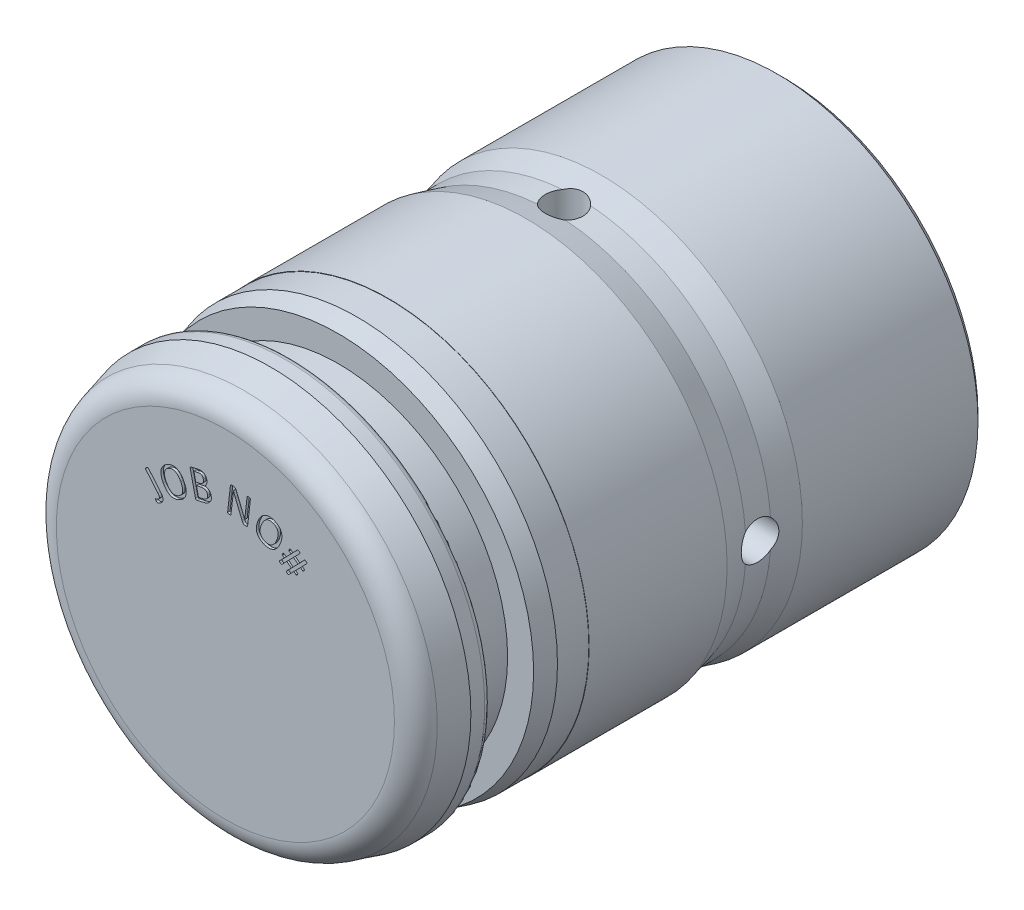
from build123d import *

# Parameters (mm, degrees)
SKETCH2_W                                            = 1.5
SKETCH2_H                                            = 8
CIRPATTERN1_COUNT                                    = 4
CSK_FOR_M2_5_CROSS_COUNTERSUNK_HEAD_SCRE_D           = 3.15
CSK_FOR_M2_5_CROSS_COUNTERSUNK_HEAD_SCRE_DEPTH       = 2.053644525
CSK_FOR_M2_5_CROSS_COUNTERSUNK_HEAD_SCRE_CSINK_D     = 4.5
CSK_FOR_M2_5_CROSS_COUNTERSUNK_HEAD_SCRE_CSINK_ANGLE = 92
CSK_FOR_M2_5_CROSS_COUNTERSUNK_HEAD_SCRE_TIP         = 0.946355475
SKETCH7_R                                            = 13.476607606
CUT_EXTRUDE1_DEPTH                                   = 50.922439908
CUT_EXTRUDE2_DEPTH                                   = 0.2


with BuildPart() as part:
    # Sketch1 → Revolve1 (revolve)
    with BuildSketch(Plane(origin=(0, 0, 0), x_dir=(0, 0, -1), z_dir=(1, 0, 0)), mode=Mode.PRIVATE) as revolve1_sk:
        with BuildLine():
            Line((34, 16), (36, 15.5))
            Line((36, 15.5), (38, 15.5))
            Line((38, 15.5), (40, 16))
            Line((40, 16), (54, 16))
            Line((54, 16), (54.5, 15.5))
            Line((54.5, 15.5), (54.5, 13.277350269))
            Line((54.5, 13.277350269), (53.5, 12.7))
            Line((53.5, 12.7), (39.445481322, 12.7))
            Line((39.445481322, 12.7), (38.003527618, 13.086370331))
            ThreePointArc((38.003527618, 13.086370331), (37.656495428, 13.017341336), (37.5, 12.7))
            Line((37.5, 12.7), (37.5, 9.577350269))
            Line((37.5, 9.577350269), (36.5, 9))
            Line((36.5, 9), (21.945481322, 9))
            Line((21.945481322, 9), (20.503527618, 9.386370331))
            ThreePointArc((20.503527618, 9.386370331), (20.156495428, 9.317341336), (20, 9))
            Line((20, 9), (20, 5))
            Line((20, 5), (16.995696905, 0))
            Line((16.995696905, 0), (0, 0))
            Line((0, 0), (0, 5))
            Line((0, 5), (10, 5))
            Line((10, 5), (10, 13.476607606))
            ThreePointArc((10, 13.476607606), (10.413293319, 14.694130464), (11.48236191, 15.408459258))
            Line((11.48236191, 15.408459258), (13.596720742, 15.975))
            Line((13.596720742, 15.975), (14.7, 15.975))
            ThreePointArc((14.7, 15.975), (15.053553391, 15.828553391), (15.2, 15.475))
            Line((15.2, 15.475), (15.2, 13.5))
            Line((15.2, 13.5), (19, 13.5))
            Line((19, 13.5), (19, 15.573076211))
            Line((19, 15.573076211), (20.5, 15.975))
            Line((20.5, 15.975), (23, 15.975))
            Line((23, 15.975), (23, 16))
            Line((23, 16), (34, 16))
        make_face()
    revolve(revolve1_sk.sketch.rotate(Axis((0, 0, 0), (0, 0, -1)), 90), axis=Axis((0, 0, 0), (0, 0, -1)))

    # Sketch2 → Cut-Revolve1 (revolve, cut)
    with BuildSketch(Plane(origin=(0, 0, 0), x_dir=(0, 0, -1), z_dir=(1, 0, 0)), mode=Mode.PRIVATE) as cut_revolve1_sk:
        with Locations((37.75, 12)):
            Rectangle(SKETCH2_W, SKETCH2_H)
    cut_revolve1 = revolve(cut_revolve1_sk.sketch.rotate(Axis((0, 16, -37), (0, -1, 0)), 228.189685086), axis=Axis((0, 16, -37), (0, -1, 0)), mode=Mode.SUBTRACT)

    # CirPattern1: Cut-Revolve1 ×4 about axis
    cirpattern1_axis = Axis((0, 0, -34), (0, 0, 1))
    for i in range(1, CIRPATTERN1_COUNT):
        add(cut_revolve1.rotate(cirpattern1_axis, i * 360 / CIRPATTERN1_COUNT), mode=Mode.SUBTRACT)

    # CSK for M2.5 Cross Countersunk Head Screw1
    with Locations(Plane.XY):
        with Locations((0, 0)):
            CounterSinkHole(CSK_FOR_M2_5_CROSS_COUNTERSUNK_HEAD_SCRE_D / 2, CSK_FOR_M2_5_CROSS_COUNTERSUNK_HEAD_SCRE_CSINK_D / 2, depth=CSK_FOR_M2_5_CROSS_COUNTERSUNK_HEAD_SCRE_DEPTH, counter_sink_angle=CSK_FOR_M2_5_CROSS_COUNTERSUNK_HEAD_SCRE_CSINK_ANGLE)
            with Locations((0, 0, -(CSK_FOR_M2_5_CROSS_COUNTERSUNK_HEAD_SCRE_DEPTH + CSK_FOR_M2_5_CROSS_COUNTERSUNK_HEAD_SCRE_TIP / 2))):  # 118° drill point
                Cone(0, CSK_FOR_M2_5_CROSS_COUNTERSUNK_HEAD_SCRE_D / 2, CSK_FOR_M2_5_CROSS_COUNTERSUNK_HEAD_SCRE_TIP, mode=Mode.SUBTRACT)

    # Sketch7 → Cut-Extrude1 (cut, through all)
    with BuildSketch(Plane.XY.offset(-10)):
        Circle(SKETCH7_R)
    extrude(amount=CUT_EXTRUDE1_DEPTH, mode=Mode.SUBTRACT)

    # Sketch8 → Cut-Extrude2 (cut)
    # profile 1 of 6: a face of its own
    with BuildSketch(Plane.XY.offset(-10)):
        with BuildLine():
            add(Edge.make_bspline(
                [(6.260781459, 6.830002782), (6.255392421, 6.823251937), (6.245424638, 6.8107653), (6.229883709, 6.79496212), (6.215150833, 6.783513313), (6.201426796, 6.775772359), (6.18806834, 6.772091301), (6.175389731, 6.771895126), (6.163862875, 6.775645539), (6.157125762, 6.779468215), (6.153780846, 6.78136614)],
                knots=[0, 0, 0, 0, 1.585463742, 2.932538266, 4.057772045, 5.003295333, 5.804780796, 6.57870779, 7.294341131, 8, 8, 8, 8], degree=3))
            Line((6.153780846, 6.78136614), (5.982579866, 6.911712341))
            Line((5.982579866, 6.911712341), (5.601268591, 6.517269173))
            Line((5.601268591, 6.517269173), (5.753014915, 6.402000331))
            add(Edge.make_bspline(
                [(5.753014915, 6.402000331), (5.758590073, 6.396410027), (5.770478598, 6.384489204), (5.770440269, 6.361319518), (5.767068702, 6.341494444), (5.75913833, 6.324157511), (5.748284318, 6.304681883), (5.738759574, 6.291811589), (5.733560258, 6.284786024)],
                knots=[0, 0, 0, 0, 1.043117624, 2.224354699, 2.946775228, 3.812145065, 4.805705605, 6, 6, 6, 6], degree=3))
            add(Edge.make_bspline(
                [(5.733560258, 6.284786024), (5.728180668, 6.278036114), (5.718158393, 6.265460907), (5.702387722, 6.249550343), (5.686722075, 6.239092766), (5.673392145, 6.230381813), (5.660004977, 6.22712137), (5.647545047, 6.226069177), (5.636257658, 6.229878394), (5.629735903, 6.233768457), (5.626559645, 6.235663015)],
                knots=[0, 0, 0, 0, 1.588142171, 2.958738167, 4.092165376, 5.053725356, 5.856564822, 6.602578649, 7.319420957, 8, 8, 8, 8], degree=3))
            Line((5.626559645, 6.235663015), (5.452440466, 6.367954682))
            Line((5.452440466, 6.367954682), (5.058483665, 5.962325086))
            add(Edge.make_bspline(
                [(5.058483665, 5.962325086), (5.055813071, 5.959801269), (5.050556351, 5.95483346), (5.041311884, 5.949067243), (5.029811592, 5.947108565), (5.016569173, 5.948865859), (5.000896152, 5.954868363), (4.982079824, 5.964916974), (4.959586499, 5.980687804), (4.943175599, 5.992917821), (4.933973861, 5.9997753)],
                knots=[0, 0, 0, 0, 0.614242039, 1.20905647, 1.788239831, 2.524253971, 3.415446644, 4.578871761, 6.081742834, 8, 8, 8, 8], degree=3))
            add(Edge.make_bspline(
                [(4.933973861, 5.9997753), (4.925051654, 6.006727675), (4.908782358, 6.019405058), (4.88680092, 6.036846582), (4.871730259, 6.0533563), (4.86059154, 6.066819748), (4.855243214, 6.079414382), (4.854471824, 6.090834027), (4.858147863, 6.101070964), (4.862921708, 6.106429953), (4.865396195, 6.109207745)],
                knots=[0, 0, 0, 0, 1.864673509, 3.400159188, 4.609467308, 5.544287496, 6.263453322, 6.824981007, 7.390937711, 8, 8, 8, 8], degree=3))
            Line((4.865396195, 6.109207745), (5.25886663, 6.514837341))
            Line((5.25886663, 6.514837341), (4.895550913, 6.790607102))
            Line((4.895550913, 6.790607102), (4.501594112, 6.385463873))
            add(Edge.make_bspline(
                [(4.501594112, 6.385463873), (4.498522748, 6.383198177), (4.492526898, 6.378775137), (4.48369997, 6.372306558), (4.472687947, 6.369718636), (4.459941703, 6.370931692), (4.445010759, 6.37731339), (4.426056196, 6.3862617), (4.404285302, 6.402647864), (4.3878089, 6.41437428), (4.378543407, 6.420968622)],
                knots=[0, 0, 0, 0, 0.648675436, 1.266329842, 1.832952999, 2.522279822, 3.400518836, 4.568238135, 6.070151066, 8, 8, 8, 8], degree=3))
            add(Edge.make_bspline(
                [(4.378543407, 6.420968622), (4.369301544, 6.428250886), (4.352564335, 6.441439221), (4.330077141, 6.459342747), (4.314838614, 6.476006452), (4.303702362, 6.489472575), (4.298353594, 6.502066729), (4.297582287, 6.513486465), (4.301258306, 6.52372338), (4.306032154, 6.529082372), (4.308506642, 6.531860166)],
                knots=[0, 0, 0, 0, 1.912748068, 3.464026874, 4.656544041, 5.578384475, 6.287564856, 6.841295863, 7.399394395, 8, 8, 8, 8], degree=3))
            Line((4.308506642, 6.531860166), (4.701004345, 6.937976128))
            Line((4.701004345, 6.937976128), (4.549258021, 7.05324497))
            add(Edge.make_bspline(
                [(4.549258021, 7.05324497), (4.543815426, 7.059001284), (4.53251164, 7.070956638), (4.530248895, 7.093646184), (4.535190759, 7.112737911), (4.54181828, 7.13040149), (4.553727353, 7.149277476), (4.5628236, 7.162396154), (4.567739945, 7.169486544)],
                knots=[0, 0, 0, 0, 1.069317819, 2.220877998, 2.931803983, 3.795872364, 4.808711869, 6, 6, 6, 6], degree=3))
            add(Edge.make_bspline(
                [(4.567739945, 7.169486544), (4.573098097, 7.17610876), (4.583077422, 7.18844235), (4.59923175, 7.203651854), (4.614318306, 7.214724536), (4.627725911, 7.223116555), (4.640658476, 7.228016865), (4.653272994, 7.228247395), (4.665396146, 7.226119002), (4.672249147, 7.221777091), (4.675713291, 7.219582286)],
                knots=[0, 0, 0, 0, 1.556242223, 2.898433828, 4.04270965, 4.97307966, 5.788695267, 6.530389247, 7.25712215, 8, 8, 8, 8], degree=3))
            Line((4.675713291, 7.219582286), (4.850805203, 7.086804253))
            Line((4.850805203, 7.086804253), (5.233575576, 7.480274688))
            Line((5.233575576, 7.480274688), (5.075506489, 7.599920827))
            add(Edge.make_bspline(
                [(5.075506489, 7.599920827), (5.069985597, 7.605679466), (5.058419075, 7.617744075), (5.057396303, 7.640574947), (5.06110296, 7.659862334), (5.068338396, 7.676790651), (5.078569322, 7.695490297), (5.087655927, 7.707679529), (5.092529314, 7.714216937)],
                knots=[0, 0, 0, 0, 1.090307583, 2.284244036, 3.004444687, 3.864255633, 4.854543841, 6, 6, 6, 6], degree=3))
            add(Edge.make_bspline(
                [(5.092529314, 7.714216937), (5.098089875, 7.721284352), (5.108402419, 7.734391489), (5.124267597, 7.751125455), (5.139523842, 7.76323454), (5.157294098, 7.772614631), (5.179867334, 7.777579752), (5.194520077, 7.76957259), (5.201475392, 7.765771777)],
                knots=[0, 0, 0, 0, 1.210425649, 2.244839576, 3.100739761, 3.813534997, 4.962136101, 6, 6, 6, 6], degree=3))
            Line((5.201475392, 7.765771777), (5.379485503, 7.630561912))
            Line((5.379485503, 7.630561912), (5.751555815, 8.009927721))
            add(Edge.make_bspline(
                [(5.751555815, 8.009927721), (5.75435087, 8.012534766), (5.759653855, 8.017481046), (5.769769865, 8.022139091), (5.781382305, 8.024335537), (5.795393983, 8.021607521), (5.812069383, 8.015534526), (5.83220298, 8.004873159), (5.856212692, 7.989528488), (5.8730722, 7.976979797), (5.882388383, 7.970045674)],
                knots=[0, 0, 0, 0, 0.610955433, 1.159149706, 1.767875367, 2.47958279, 3.419728211, 4.620874901, 6.132771931, 8, 8, 8, 8], degree=3))
            add(Edge.make_bspline(
                [(5.882388383, 7.970045674), (5.891609161, 7.963082924), (5.90806768, 7.950654847), (5.928300018, 7.931819789), (5.942905842, 7.916230374), (5.952275354, 7.902928047), (5.957011156, 7.890967827), (5.956511938, 7.880316188), (5.95252599, 7.871374276), (5.948949584, 7.866228456), (5.947075117, 7.863531428)],
                knots=[0, 0, 0, 0, 1.986804467, 3.546322913, 4.751095073, 5.65636833, 6.335717192, 6.922228838, 7.435118393, 8, 8, 8, 8], degree=3))
            Line((5.947075117, 7.863531428), (5.573059339, 7.483679253))
            Line((5.573059339, 7.483679253), (5.936375055, 7.207909492))
            Line((5.936375055, 7.207909492), (6.305527169, 7.589220766))
            add(Edge.make_bspline(
                [(6.305527169, 7.589220766), (6.308335688, 7.591653775), (6.313958121, 7.596524468), (6.324576798, 7.600972173), (6.336697584, 7.602493388), (6.350594068, 7.599981105), (6.367021365, 7.594393037), (6.386878767, 7.584108468), (6.410936407, 7.568574638), (6.428167955, 7.555932719), (6.437818836, 7.548852353)],
                knots=[0, 0, 0, 0, 0.591456287, 1.184048898, 1.811383024, 2.519327369, 3.421549894, 4.581491105, 6.085394137, 8, 8, 8, 8], degree=3))
            add(Edge.make_bspline(
                [(6.437818836, 7.548852353), (6.446862425, 7.541869431), (6.463265101, 7.529204261), (6.483537352, 7.510270892), (6.498362673, 7.494706002), (6.507281717, 7.481347005), (6.511255541, 7.469534438), (6.511472308, 7.459040618), (6.507843748, 7.449804198), (6.503632691, 7.445146864), (6.501532837, 7.442824473)],
                knots=[0, 0, 0, 0, 1.973985317, 3.580286544, 4.790602399, 5.684799368, 6.33182712, 6.920370663, 7.461640368, 8, 8, 8, 8], degree=3))
            Line((6.501532837, 7.442824473), (6.129462525, 7.061513199))
            Line((6.129462525, 7.061513199), (6.279749749, 6.94721709))
            add(Edge.make_bspline(
                [(6.279749749, 6.94721709), (6.285247067, 6.941457087), (6.296992743, 6.929150153), (6.298111643, 6.905649413), (6.293558262, 6.886047723), (6.286520013, 6.868506934), (6.274947455, 6.849793952), (6.265728457, 6.836914183), (6.260781459, 6.830002782)],
                knots=[0, 0, 0, 0, 1.06110144, 2.267169949, 2.994302627, 3.831081759, 4.83613885, 6, 6, 6, 6], degree=3))
        make_face()
        Polygon((5.426176679, 7.333878395), (5.044379038, 6.939921593), (5.406235656, 6.665124565), (5.790465129, 7.057135901), align=None, mode=Mode.SUBTRACT)
    # profile 2 of 6: a face of its own
    with BuildSketch(Plane.XY.offset(-10)):
        with BuildLine():
            add(Edge.make_bspline(
                [(4.374029615, 7.750312123), (4.357364755, 7.711806452), (4.324736361, 7.636415584), (4.268149739, 7.530048713), (4.207406159, 7.432099581), (4.141660797, 7.343606082), (4.072339953, 7.263744696), (3.998155965, 7.194322075), (3.919849029, 7.135100096), (3.837966362, 7.085373345), (3.751612108, 7.046877581), (3.661656585, 7.018120099), (3.567457298, 7.001539268), (3.469782172, 6.994349952), (3.368277258, 6.999666792), (3.263475247, 7.01640966), (3.155220765, 7.045227789), (3.083938942, 7.073058979), (3.047222017, 7.087394691)],
                knots=[0, 0, 0, 0, 1.193394181, 2.336565484, 3.424498174, 4.469779062, 5.470007252, 6.429519284, 7.354859414, 8.259079089, 9.148971895, 10.038900566, 10.939158173, 11.863980772, 12.819949185, 13.824031056, 14.879168859, 16, 16, 16, 16], degree=3))
            add(Edge.make_bspline(
                [(3.047222017, 7.087394691), (3.011743395, 7.102993509), (2.943149682, 7.133151977), (2.848194338, 7.187049719), (2.763881468, 7.245876273), (2.690419149, 7.310282395), (2.627662126, 7.379743315), (2.575245973, 7.453777231), (2.532226577, 7.532012565), (2.500634503, 7.615420252), (2.479132239, 7.703476117), (2.467672085, 7.796165139), (2.465911041, 7.893613414), (2.474020414, 7.995663031), (2.491707574, 8.102365685), (2.519518649, 8.21314739), (2.555342377, 8.328677731), (2.585934524, 8.405641058), (2.601710375, 8.44532974)],
                knots=[0, 0, 0, 0, 1.136319349, 2.196938858, 3.197072658, 4.147329943, 5.056522752, 5.93666825, 6.802812793, 7.668382657, 8.545013404, 9.455796929, 10.402393608, 11.399265577, 12.454765395, 13.57131697, 14.747569374, 16, 16, 16, 16], degree=3))
            add(Edge.make_bspline(
                [(2.601710375, 8.44532974), (2.618010739, 8.483048161), (2.649855857, 8.556736549), (2.706071296, 8.660491727), (2.765337111, 8.756899641), (2.830821402, 8.843983084), (2.900154456, 8.922698919), (2.97400393, 8.991465622), (3.052081679, 9.050042938), (3.134055774, 9.098499499), (3.220363242, 9.136801888), (3.310636318, 9.164615502), (3.404839664, 9.181686605), (3.502741475, 9.187949271), (3.604223992, 9.182968356), (3.709013045, 9.166017986), (3.817115271, 9.137293434), (3.888396691, 9.109454817), (3.925113408, 9.095115279)],
                knots=[0, 0, 0, 0, 1.176456083, 2.298377034, 3.376910023, 4.41529402, 5.415304523, 6.37812314, 7.300408847, 8.205975924, 9.099978399, 9.998960489, 10.905289328, 11.836036068, 12.803089969, 13.809356579, 14.871610106, 16, 16, 16, 16], degree=3))
            add(Edge.make_bspline(
                [(3.925113408, 9.095115279), (3.959963462, 9.07987317), (4.027500951, 9.0503348), (4.120662682, 8.996706276), (4.204307587, 8.939008706), (4.277053987, 8.874985787), (4.339777578, 8.806186141), (4.392419206, 8.732575358), (4.435040147, 8.654171874), (4.467867543, 8.571072247), (4.490171741, 8.483280682), (4.502746306, 8.391113157), (4.505612092, 8.294270985), (4.497779769, 8.19304946), (4.481069397, 8.087688137), (4.454964212, 7.978311841), (4.419439854, 7.864902593), (4.389441083, 7.789202193), (4.374029615, 7.750312123)],
                knots=[0, 0, 0, 0, 1.125861885, 2.181858496, 3.178301479, 4.130985709, 5.045423654, 5.930180416, 6.804714192, 7.682143433, 8.569606438, 9.480950256, 10.432156948, 11.433539705, 12.48351445, 13.588831494, 14.761294367, 16, 16, 16, 16], degree=3))
        make_face()
        with BuildLine():
            add(Edge.make_bspline(
                [(4.091450724, 7.845639942), (4.10240631, 7.873267029), (4.123889782, 7.927442662), (4.151258902, 8.009068097), (4.173543643, 8.089128298), (4.191376972, 8.167587357), (4.203442014, 8.244080589), (4.207804044, 8.318342993), (4.205516335, 8.389853698), (4.196312574, 8.458657682), (4.180312144, 8.524861669), (4.154220854, 8.587154031), (4.121262688, 8.646450346), (4.079173625, 8.70201945), (4.028414673, 8.754007466), (3.967151949, 8.800604059), (3.896745057, 8.843477526), (3.844684948, 8.866322209), (3.817626429, 8.878195855)],
                knots=[0, 0, 0, 0, 1.169145165, 2.292647769, 3.3852338, 4.437530758, 5.456893215, 6.428122432, 7.359928579, 8.267424953, 9.15541128, 10.030753632, 10.916078564, 11.817998595, 12.765199665, 13.765464758, 14.838588412, 16, 16, 16, 16], degree=3))
            add(Edge.make_bspline(
                [(3.817626429, 8.878195855), (3.790097306, 8.888653437), (3.736971863, 8.908834382), (3.656777326, 8.928899065), (3.579644277, 8.936715052), (3.506030846, 8.934392328), (3.436025693, 8.92243832), (3.369475416, 8.902870874), (3.306038334, 8.875945607), (3.246185256, 8.841138105), (3.189436909, 8.799396453), (3.13575998, 8.751082808), (3.085667859, 8.695830851), (3.039262654, 8.634508851), (2.996201616, 8.568243927), (2.95598785, 8.498406056), (2.918768958, 8.42519292), (2.896835715, 8.374602743), (2.885748365, 8.349029188)],
                knots=[0, 0, 0, 0, 1.162333523, 2.243060363, 3.253399692, 4.214251443, 5.142559219, 6.05012643, 6.947931396, 7.857168051, 8.777850264, 9.72529952, 10.70417548, 11.718300799, 12.758857461, 13.822939541, 14.899486486, 16, 16, 16, 16], degree=3))
            add(Edge.make_bspline(
                [(2.885748365, 8.349029188), (2.874445506, 8.320599164), (2.852212153, 8.264675723), (2.824267661, 8.180658745), (2.800674232, 8.098605019), (2.781963126, 8.018849745), (2.769533569, 7.941341628), (2.764060142, 7.866647556), (2.765278981, 7.794793696), (2.773866772, 7.725883755), (2.790345504, 7.660073942), (2.815369761, 7.597984903), (2.8484386, 7.539205096), (2.890105871, 7.483940136), (2.941073805, 7.432215049), (3.003142552, 7.38625175), (3.074103387, 7.34288394), (3.126830222, 7.319741524), (3.15422263, 7.30771868)],
                knots=[0, 0, 0, 0, 1.192592052, 2.345894933, 3.450268716, 4.520489015, 5.537831291, 6.507398402, 7.436738483, 8.335193501, 9.209009476, 10.0740487, 10.937238559, 11.830990001, 12.765111078, 13.757485069, 14.834978712, 16, 16, 16, 16], degree=3))
            add(Edge.make_bspline(
                [(3.15422263, 7.30771868), (3.182060794, 7.297041145), (3.235764389, 7.276442732), (3.316918801, 7.256732587), (3.394590058, 7.248231946), (3.468746164, 7.249952515), (3.539425103, 7.262036226), (3.606736567, 7.281906531), (3.670586526, 7.309931987), (3.730697313, 7.345750753), (3.787145341, 7.38885364), (3.840328475, 7.438410072), (3.890617705, 7.493812397), (3.936597672, 7.556013667), (3.979333582, 7.623081941), (4.020533383, 7.693507929), (4.057900809, 7.768046882), (4.080186719, 7.819588948), (4.091450724, 7.845639942)],
                knots=[0, 0, 0, 0, 1.164984794, 2.247413766, 3.254790523, 4.212347683, 5.137786136, 6.050390847, 6.950224405, 7.85693152, 8.779935062, 9.721943167, 10.695894911, 11.701295106, 12.742258959, 13.804545605, 14.890347734, 16, 16, 16, 16], degree=3))
        make_face(mode=Mode.SUBTRACT)
    # profile 3 of 6: a face of its own
    with BuildSketch(Plane.XY.offset(-10)):
        with BuildLine():
            add(Edge.make_bspline(
                [(1.775456235, 7.709775673), (1.773780774, 7.699771884), (1.770637876, 7.681006381), (1.759732819, 7.65615401), (1.745099938, 7.636344213), (1.727502012, 7.621290608), (1.707785246, 7.610331866), (1.686519794, 7.604092016), (1.664760714, 7.601599415), (1.650296812, 7.602712538), (1.643164569, 7.603261426)],
                knots=[0, 0, 0, 0, 1.269617075, 2.381598067, 3.3709206, 4.338003565, 5.267284038, 6.181731029, 7.103399826, 8, 8, 8, 8], degree=3))
            Line((1.643164569, 7.603261426), (1.553673147, 7.613475121))
            add(Edge.make_bspline(
                [(1.553673147, 7.613475121), (1.54047306, 7.615386753), (1.515643164, 7.618982609), (1.480861579, 7.629655197), (1.45011714, 7.646499449), (1.422452244, 7.670601628), (1.39709763, 7.702710992), (1.372499404, 7.743119104), (1.348359115, 7.793797386), (1.332681489, 7.831291211), (1.324108196, 7.851794668)],
                knots=[0, 0, 0, 0, 0.906811249, 1.705748527, 2.461153876, 3.274807175, 4.184499217, 5.2345928, 6.487740083, 8, 8, 8, 8], degree=3))
            Line((1.324108196, 7.851794668), (0.796400629, 9.124615593))
            add(Edge.make_bspline(
                [(0.796400629, 9.124615593), (0.782541088, 9.158304727), (0.754364011, 9.226796268), (0.713323574, 9.330759913), (0.674517868, 9.435447107), (0.649914386, 9.505246257), (0.637845175, 9.53948615)],
                knots=[0, 0, 0, 0, 0.984096472, 2.000712879, 3.019251983, 4, 4, 4, 4], degree=3))
            Line((0.637845175, 9.53948615), (0.634926977, 9.539972517))
            add(Edge.make_bspline(
                [(0.634926977, 9.539972517), (0.631409783, 9.500410156), (0.624301257, 9.420451498), (0.61266986, 9.299987872), (0.600141771, 9.178703739), (0.5909027, 9.097857438), (0.586290334, 9.057497027)],
                knots=[0, 0, 0, 0, 0.982847315, 1.986412137, 2.994768685, 4, 4, 4, 4], degree=3))
            Line((0.586290334, 9.057497027), (0.441839507, 7.7875943))
            add(Edge.make_bspline(
                [(0.441839507, 7.7875943), (0.441069017, 7.783953048), (0.439464019, 7.776368003), (0.432884555, 7.766098614), (0.422667555, 7.757191205), (0.407753739, 7.752421805), (0.389142362, 7.74911032), (0.365511337, 7.747179457), (0.33607253, 7.747958032), (0.314562278, 7.749996391), (0.302738711, 7.751116818)],
                knots=[0, 0, 0, 0, 0.563321112, 1.173446747, 1.821878042, 2.588077591, 3.518312153, 4.708178956, 6.190580698, 8, 8, 8, 8], degree=3))
            add(Edge.make_bspline(
                [(0.302738711, 7.751116818), (0.290879462, 7.75254405), (0.269453361, 7.75512263), (0.240715798, 7.761196546), (0.21866631, 7.769133627), (0.201010909, 7.775120849), (0.188173437, 7.783853848), (0.180107316, 7.79471123), (0.176764883, 7.806692024), (0.176768212, 7.814494743), (0.176769808, 7.818235385)],
                knots=[0, 0, 0, 0, 1.825575509, 3.298266733, 4.473519112, 5.407497698, 6.136196296, 6.810189845, 7.429602235, 8, 8, 8, 8], degree=3))
            Line((0.176769808, 7.818235385), (0.398066529, 9.759810139))
            add(Edge.make_bspline(
                [(0.398066529, 9.759810139), (0.399689345, 9.769931633), (0.402710731, 9.788775999), (0.411735461, 9.814416946), (0.425599111, 9.834792785), (0.449406043, 9.853086837), (0.483130002, 9.867704584), (0.51157048, 9.867431041), (0.525494532, 9.867297119)],
                knots=[0, 0, 0, 0, 0.980231525, 1.825011514, 2.582898093, 3.300450048, 4.678338941, 6, 6, 6, 6], degree=3))
            Line((0.525494532, 9.867297119), (0.658758931, 9.85221976))
            add(Edge.make_bspline(
                [(0.658758931, 9.85221976), (0.673291013, 9.850434025), (0.699812459, 9.847175009), (0.73563368, 9.835799162), (0.766232747, 9.821939774), (0.791580156, 9.801287515), (0.814946819, 9.775737566), (0.834874819, 9.741966968), (0.855469878, 9.701112142), (0.868258229, 9.670737538), (0.875191989, 9.654268626)],
                knots=[0, 0, 0, 0, 1.114294287, 2.033617597, 2.857836399, 3.659474723, 4.508919341, 5.486936209, 6.637433188, 8, 8, 8, 8], degree=3))
            Line((0.875191989, 9.654268626), (1.280335218, 8.672294821))
            add(Edge.make_bspline(
                [(1.280335218, 8.672294821), (1.292698847, 8.642806128), (1.317122503, 8.584552868), (1.352568708, 8.497953791), (1.386880236, 8.413104117), (1.419269414, 8.329467053), (1.450863808, 8.247201449), (1.482029957, 8.166092709), (1.513602724, 8.08558874), (1.533802838, 8.03161519), (1.543945819, 8.004513724)],
                knots=[0, 0, 0, 0, 1.068853708, 2.111460647, 3.127865415, 4.128207762, 5.109475872, 6.073624629, 7.032718857, 8, 8, 8, 8], degree=3))
            Line((1.543945819, 8.004513724), (1.545404918, 8.004513724))
            add(Edge.make_bspline(
                [(1.545404918, 8.004513724), (1.549604388, 8.048450144), (1.558144503, 8.137800012), (1.5713398, 8.272749721), (1.586607066, 8.407385092), (1.596492702, 8.496714539), (1.601337056, 8.540489521)],
                knots=[0, 0, 0, 0, 0.982825258, 1.998690524, 3.019278776, 4, 4, 4, 4], degree=3))
            Line((1.601337056, 8.540489521), (1.731683257, 9.681991512))
            add(Edge.make_bspline(
                [(1.731683257, 9.681991512), (1.732435012, 9.685640014), (1.7339276, 9.692884009), (1.740413974, 9.702799235), (1.750559878, 9.711293733), (1.765416037, 9.717434682), (1.784312235, 9.721546315), (1.808343723, 9.723453262), (1.838269901, 9.7219809), (1.860421098, 9.71972339), (1.87272952, 9.718468994)],
                knots=[0, 0, 0, 0, 0.556430162, 1.104776164, 1.745275381, 2.520753733, 3.497406642, 4.648403133, 6.137668638, 8, 8, 8, 8], degree=3))
            add(Edge.make_bspline(
                [(1.87272952, 9.718468994), (1.883790531, 9.717214582), (1.9042446, 9.714894919), (1.932084634, 9.708766737), (1.955218564, 9.702773412), (1.972410633, 9.693835062), (1.985091925, 9.684536906), (1.992460551, 9.673933227), (1.997071625, 9.663067315), (1.996860032, 9.655610326), (1.996752957, 9.651836794)],
                knots=[0, 0, 0, 0, 1.730224232, 3.199537857, 4.436567528, 5.429336705, 6.201470163, 6.852438238, 7.419288387, 8, 8, 8, 8], degree=3))
            Line((1.996752957, 9.651836794), (1.775456235, 7.709775673))
        make_face()
    # profile 4 of 6: a face of its own
    with BuildSketch(Plane.XY.offset(-10)):
        with BuildLine():
            add(Edge.make_bspline(
                [(-1.135852915, 8.309649471), (-1.132563336, 8.293636923), (-1.126116655, 8.262256678), (-1.120158969, 8.21529301), (-1.118256674, 8.16957695), (-1.120303239, 8.111102044), (-1.129315496, 8.040631791), (-1.154265795, 7.961320837), (-1.189441617, 7.887525206), (-1.236812346, 7.82063836), (-1.294448064, 7.759974059), (-1.361317445, 7.705435067), (-1.437047408, 7.657995171), (-1.505864015, 7.624234383), (-1.565177625, 7.599931498), (-1.614455117, 7.584654944), (-1.666851837, 7.568421442), (-1.703538459, 7.560075066), (-1.72241082, 7.555781518)],
                knots=[0, 0, 0, 0, 0.727033493, 1.424788157, 2.103343893, 2.760006201, 4.026801621, 5.249553744, 6.443050371, 7.649550795, 8.879111534, 10.155336283, 11.477915823, 12.845488795, 13.560656415, 14.326979299, 15.139363387, 16, 16, 16, 16], degree=3))
            Line((-1.72241082, 7.555781518), (-2.261791181, 7.434189912))
            add(Edge.make_bspline(
                [(-2.261791181, 7.434189912), (-2.274126119, 7.432745862), (-2.299596333, 7.429764067), (-2.331856345, 7.438939277), (-2.355269204, 7.454080631), (-2.370187846, 7.472058399), (-2.38177537, 7.495408497), (-2.386624612, 7.513193036), (-2.389219184, 7.522708601)],
                knots=[0, 0, 0, 0, 1.268367937, 2.61903264, 3.340113389, 4.108377322, 4.987892986, 6, 6, 6, 6], degree=3))
            Line((-2.389219184, 7.522708601), (-2.804576108, 9.364091873))
            add(Edge.make_bspline(
                [(-2.804576108, 9.364091873), (-2.806359016, 9.373780985), (-2.809699678, 9.391935627), (-2.809601834, 9.417937645), (-2.803874708, 9.44067472), (-2.788441518, 9.464032124), (-2.763994156, 9.487145794), (-2.739488949, 9.495360122), (-2.727730213, 9.499301738)],
                knots=[0, 0, 0, 0, 1.00906513, 1.890701403, 2.649223011, 3.37379976, 4.739827311, 6, 6, 6, 6], degree=3))
            Line((-2.727730213, 9.499301738), (-2.258386616, 9.604843252))
            add(Edge.make_bspline(
                [(-2.258386616, 9.604843252), (-2.228794723, 9.611271252), (-2.172326925, 9.62353728), (-2.090512051, 9.63435173), (-2.016282909, 9.640555966), (-1.948856252, 9.638984344), (-1.887068089, 9.632032888), (-1.829703633, 9.620869794), (-1.776540954, 9.603387021), (-1.727018726, 9.581731469), (-1.681824245, 9.554280671), (-1.640254788, 9.522426217), (-1.603257811, 9.485094049), (-1.570065126, 9.44320475), (-1.541401042, 9.39651713), (-1.516360964, 9.345879977), (-1.496487144, 9.290441888), (-1.486683853, 9.251671119), (-1.481659441, 9.231800206)],
                knots=[0, 0, 0, 0, 1.477270274, 2.818954483, 4.024785879, 5.109045773, 6.104280889, 7.057061098, 7.955354765, 8.830239667, 9.689200813, 10.529594005, 11.380021546, 12.247504521, 13.132351023, 14.048859394, 14.999995459, 16, 16, 16, 16], degree=3))
            add(Edge.make_bspline(
                [(-1.481659441, 9.231800206), (-1.476928257, 9.207569539), (-1.46758986, 9.159743114), (-1.465505159, 9.087652717), (-1.472561371, 9.017868126), (-1.489811722, 8.951397922), (-1.516065803, 8.887985458), (-1.553600137, 8.829793228), (-1.599775443, 8.775648854), (-1.637536448, 8.746275804), (-1.656751353, 8.731329159)],
                knots=[0, 0, 0, 0, 1.049898, 2.072285785, 3.058120712, 4.027671814, 4.986818195, 5.967490188, 6.965745687, 8, 8, 8, 8], degree=3))
            add(Edge.make_bspline(
                [(-1.656751353, 8.731329159), (-1.627633059, 8.730895816), (-1.569737954, 8.730034212), (-1.498810947, 8.713746798), (-1.444600551, 8.694582828), (-1.405435631, 8.676364603), (-1.367930453, 8.655019284), (-1.332286675, 8.630091128), (-1.29866139, 8.601713785), (-1.266773183, 8.570093938), (-1.237850771, 8.534455222), (-1.210912671, 8.49583529), (-1.186477217, 8.454040258), (-1.165623557, 8.408778581), (-1.148503358, 8.360377081), (-1.140117667, 8.326750902), (-1.135852915, 8.309649471)],
                knots=[0, 0, 0, 0, 1.672941484, 3.326263643, 4.15884532, 4.981584203, 5.809390689, 6.640610825, 7.481988815, 8.340029372, 9.222054328, 10.120569903, 11.049128478, 12.005513456, 12.985654229, 14, 14, 14, 14], degree=3))
        make_face()
        with BuildLine():
            add(Edge.make_bspline(
                [(-1.757915569, 9.140849686), (-1.764261298, 9.164461329), (-1.776487449, 9.209953265), (-1.802323589, 9.262282625), (-1.827349561, 9.298394001), (-1.847688863, 9.322953939), (-1.871874707, 9.343037856), (-1.897823837, 9.360838305), (-1.926424307, 9.375765424), (-1.958089227, 9.386741552), (-1.992540958, 9.39438924), (-2.029952996, 9.399498513), (-2.071509148, 9.40013527), (-2.117862609, 9.397135387), (-2.169331208, 9.389618132), (-2.20508756, 9.382127844), (-2.2238546, 9.378196499)],
                knots=[0, 0, 0, 0, 1.703671593, 3.282419501, 4.038810136, 4.7690213, 5.499232464, 6.224164924, 6.963003502, 7.743139924, 8.555591377, 9.422916366, 10.373615977, 11.450649028, 12.661950436, 14, 14, 14, 14], degree=3))
            Line((-2.2238546, 9.378196499), (-2.507892591, 9.313996132))
            Line((-2.507892591, 9.313996132), (-2.357119, 8.645242302))
            Line((-2.357119, 8.645242302), (-2.044385391, 8.715765433))
            add(Edge.make_bspline(
                [(-2.044385391, 8.715765433), (-2.027441668, 8.719845718), (-1.995286514, 8.727589128), (-1.950655721, 8.743227224), (-1.912021895, 8.761135055), (-1.878671665, 8.781316382), (-1.850423688, 8.803904537), (-1.825706106, 8.828074956), (-1.804307586, 8.853796395), (-1.786021241, 8.881266436), (-1.771455725, 8.910558678), (-1.760293437, 8.941248718), (-1.752351217, 8.97320377), (-1.74686929, 9.017419835), (-1.746054806, 9.074024256), (-1.753957836, 9.118551187), (-1.757915569, 9.140849686)],
                knots=[0, 0, 0, 0, 1.255795599, 2.38320117, 3.402764757, 4.320811026, 5.186002572, 6.004211736, 6.809293698, 7.593751136, 8.377773128, 9.161620874, 9.943985957, 10.745667347, 12.370273249, 14, 14, 14, 14], degree=3))
        make_face(mode=Mode.SUBTRACT)
        with BuildLine():
            add(Edge.make_bspline(
                [(-1.421350005, 8.228912645), (-1.425203145, 8.2437201), (-1.432698126, 8.272522991), (-1.447029629, 8.313893456), (-1.465705558, 8.351124652), (-1.486677227, 8.385145382), (-1.5104974, 8.41551182), (-1.537586671, 8.442007889), (-1.567468107, 8.465012379), (-1.600077877, 8.484538482), (-1.635589648, 8.500130182), (-1.673831293, 8.512481866), (-1.715142081, 8.520520988), (-1.759586707, 8.524880336), (-1.807929395, 8.525321131), (-1.860703683, 8.521007416), (-1.918466338, 8.513488079), (-1.958030203, 8.504832705), (-1.978725924, 8.500305108)],
                knots=[0, 0, 0, 0, 1.036551262, 2.016259651, 2.959389644, 3.852386992, 4.720378869, 5.566980724, 6.412798457, 7.26988056, 8.135297303, 9.034957145, 9.98706256, 10.980527707, 12.056988271, 13.25743396, 14.565373156, 16, 16, 16, 16], degree=3))
            Line((-1.978725924, 8.500305108), (-2.307509625, 8.426377412))
            Line((-2.307509625, 8.426377412), (-2.143604141, 7.698773246))
            Line((-2.143604141, 7.698773246), (-1.744297309, 7.788751034))
            add(Edge.make_bspline(
                [(-1.744297309, 7.788751034), (-1.729141899, 7.792373633), (-1.699815062, 7.799383629), (-1.658459471, 7.813955185), (-1.620136819, 7.829181875), (-1.574676133, 7.852875534), (-1.524824109, 7.88873486), (-1.482387534, 7.931690331), (-1.455974447, 7.970696938), (-1.439093032, 8.001704774), (-1.425890127, 8.034822199), (-1.416895803, 8.070152381), (-1.41055928, 8.107245034), (-1.410216168, 8.146436394), (-1.412629253, 8.187423498), (-1.418395832, 8.214858111), (-1.421350005, 8.228912645)],
                knots=[0, 0, 0, 0, 1.05988008, 2.050946249, 2.981298155, 3.864790024, 5.533708442, 7.141418106, 7.943339179, 8.733327147, 9.540696322, 10.362417193, 11.211469401, 12.094547683, 13.023851895, 14, 14, 14, 14], degree=3))
        make_face(mode=Mode.SUBTRACT)
    # profile 5 of 6: a face of its own
    with BuildSketch(Plane.XY.offset(-10)):
        with BuildLine():
            add(Edge.make_bspline(
                [(-3.30628521, 8.220601647), (-3.28725824, 8.183405855), (-3.250083684, 8.110733376), (-3.204748926, 7.999955307), (-3.16739044, 7.89173088), (-3.141337057, 7.785201184), (-3.124379824, 7.681617189), (-3.117834462, 7.580934442), (-3.121554537, 7.48358766), (-3.135684969, 7.389440394), (-3.160083216, 7.298785102), (-3.195181294, 7.211545909), (-3.24203575, 7.128643945), (-3.298690404, 7.049196443), (-3.366678534, 6.974685454), (-3.446059701, 6.905114315), (-3.536453993, 6.840337076), (-3.602905834, 6.803026229), (-3.637014377, 6.783875238)],
                knots=[0, 0, 0, 0, 1.195544121, 2.335832868, 3.423369774, 4.470216222, 5.471288482, 6.424627978, 7.353593059, 8.254794151, 9.144206466, 10.035348698, 10.939175116, 11.863910529, 12.82328616, 13.819613464, 14.880846577, 16, 16, 16, 16], degree=3))
            add(Edge.make_bspline(
                [(-3.637014377, 6.783875238), (-3.671246243, 6.766509879), (-3.737669994, 6.732814015), (-3.839214164, 6.694758294), (-3.937453143, 6.66648333), (-4.033204884, 6.651388941), (-4.126022861, 6.647540433), (-4.215940377, 6.6533196), (-4.302890126, 6.671412268), (-4.387108992, 6.69910927), (-4.468648626, 6.738007648), (-4.546829369, 6.788129163), (-4.623029035, 6.84809932), (-4.696227541, 6.918865566), (-4.766707909, 6.99994984), (-4.834372577, 7.091001309), (-4.89964283, 7.191764726), (-4.939455749, 7.263823701), (-4.959931043, 7.300882744)],
                knots=[0, 0, 0, 0, 1.132394154, 2.19730552, 3.195966726, 4.145718783, 5.051116595, 5.933968781, 6.798467173, 7.665716983, 8.545606221, 9.457809736, 10.401900968, 11.403871265, 12.45879765, 13.570150045, 14.750358105, 16, 16, 16, 16], degree=3))
            add(Edge.make_bspline(
                [(-4.959931043, 7.300882744), (-4.978437261, 7.337117849), (-5.014737288, 7.408193168), (-5.059386419, 7.51667148), (-5.094498722, 7.623709228), (-5.12134064, 7.728710728), (-5.137420604, 7.831796409), (-5.143556416, 7.931982591), (-5.13921941, 8.028994784), (-5.124832728, 8.122910769), (-5.099279735, 8.213284463), (-5.06369359, 8.300136037), (-5.016770175, 8.382723397), (-4.960224418, 8.462062688), (-4.892221418, 8.536745312), (-4.812586527, 8.605876423), (-4.722272521, 8.670557008), (-4.656015967, 8.70775775), (-4.62190638, 8.726909092)],
                knots=[0, 0, 0, 0, 1.172031628, 2.298945271, 3.375872775, 4.415968912, 5.418250847, 6.377545258, 7.303454974, 8.211263501, 9.108979648, 10.003395827, 10.909062356, 11.8398498, 12.805504169, 13.811860282, 14.873522157, 16, 16, 16, 16], degree=3))
            add(Edge.make_bspline(
                [(-4.62190638, 8.726909092), (-4.588108546, 8.743811002), (-4.522581617, 8.776580268), (-4.423078158, 8.815640888), (-4.325618097, 8.841877836), (-4.230970843, 8.858072268), (-4.138591509, 8.862223048), (-4.048845789, 8.857000603), (-3.961764413, 8.839287707), (-3.877154434, 8.812254157), (-3.795480108, 8.773593292), (-3.716255185, 8.725411237), (-3.640476861, 8.665703971), (-3.56771608, 8.595720625), (-3.496997843, 8.516416129), (-3.430117569, 8.426623866), (-3.364979774, 8.328062711), (-3.32619851, 8.257059954), (-3.30628521, 8.220601647)],
                knots=[0, 0, 0, 0, 1.125146134, 2.181422964, 3.177026259, 4.126397219, 5.035179703, 5.925496316, 6.796674914, 7.674664333, 8.564627367, 9.481328004, 10.430772633, 11.431421128, 12.484791555, 13.591469155, 14.763274008, 16, 16, 16, 16], degree=3))
        make_face()
        with BuildLine():
            add(Edge.make_bspline(
                [(-3.558709383, 8.064478026), (-3.572956494, 8.090194668), (-3.600961418, 8.140744746), (-3.6454402, 8.21367822), (-3.693532097, 8.280944834), (-3.742119693, 8.344514094), (-3.793419904, 8.401839591), (-3.847239689, 8.452559941), (-3.903636038, 8.495892579), (-3.962387563, 8.532212368), (-4.023401541, 8.561578843), (-4.087691601, 8.581432961), (-4.154353307, 8.593110401), (-4.223504452, 8.596786099), (-4.295347033, 8.590140368), (-4.369814231, 8.573198946), (-4.446961951, 8.545761582), (-4.497482319, 8.520597211), (-4.523660363, 8.507557836)],
                knots=[0, 0, 0, 0, 1.164007252, 2.288038145, 3.379713352, 4.436407789, 5.454558529, 6.421846458, 7.360337522, 8.265280589, 9.152521686, 10.033611666, 10.920062968, 11.826234496, 12.767093276, 13.76686802, 14.842862202, 16, 16, 16, 16], degree=3))
            add(Edge.make_bspline(
                [(-4.523660363, 8.507557836), (-4.549337189, 8.493081913), (-4.598624634, 8.465294942), (-4.66401414, 8.415283044), (-4.71963135, 8.36215531), (-4.763964776, 8.303835215), (-4.798175334, 8.242437731), (-4.826279292, 8.179358762), (-4.844808884, 8.113269855), (-4.85681382, 8.04532652), (-4.860427779, 7.975475293), (-4.856976468, 7.903951494), (-4.845971203, 7.830747005), (-4.828338987, 7.75620935), (-4.804922449, 7.681092273), (-4.77654345, 7.606191083), (-4.743976369, 7.531478193), (-4.719108339, 7.482662255), (-4.706534138, 7.457979098)],
                knots=[0, 0, 0, 0, 1.169594448, 2.245071904, 3.260633373, 4.216341223, 5.142115834, 6.047759306, 6.952692711, 7.861079593, 8.783420868, 9.72472183, 10.701036602, 11.719513691, 12.764460626, 13.824205645, 14.899837335, 16, 16, 16, 16], degree=3))
            add(Edge.make_bspline(
                [(-4.706534138, 7.457979098), (-4.691833927, 7.431268971), (-4.662988375, 7.378856909), (-4.616891619, 7.30381515), (-4.568497665, 7.23425734), (-4.519318329, 7.169441875), (-4.467953957, 7.110743798), (-4.413840572, 7.05951973), (-4.357741441, 7.015417622), (-4.299593423, 6.978529253), (-4.238922528, 6.949215216), (-4.175278793, 6.929468328), (-4.109292093, 6.917439637), (-4.04060011, 6.91474919), (-3.968641054, 6.920847337), (-3.894035909, 6.939289017), (-3.815974446, 6.967042571), (-3.764832139, 6.99274796), (-3.738178592, 7.006144693)],
                knots=[0, 0, 0, 0, 1.195572127, 2.346016498, 3.451831158, 4.517491276, 5.535484261, 6.506946432, 7.435408517, 8.329740281, 9.20282413, 10.069494991, 10.935022348, 11.825957645, 12.757896314, 13.75723358, 14.83115014, 16, 16, 16, 16], degree=3))
            add(Edge.make_bspline(
                [(-3.738178592, 7.006144693), (-3.71234626, 7.020623755), (-3.662561054, 7.048528441), (-3.596570615, 7.098602277), (-3.540614977, 7.152354469), (-3.495513221, 7.210825518), (-3.460136005, 7.272485113), (-3.432133062, 7.336255607), (-3.413941599, 7.403001131), (-3.403084803, 7.471855527), (-3.40058774, 7.542634996), (-3.404285183, 7.6148048), (-3.415904632, 7.68831972), (-3.433959591, 7.762870131), (-3.458117075, 7.838212136), (-3.48662714, 7.913961085), (-3.520454296, 7.989619579), (-3.545840893, 8.039296664), (-3.558709383, 8.064478026)],
                knots=[0, 0, 0, 0, 1.164234546, 2.243764001, 3.24990899, 4.209587349, 5.138661861, 6.0417641, 6.94270019, 7.853186907, 8.779101442, 9.724743256, 10.692951881, 11.703456866, 12.740620122, 13.804730191, 14.887215642, 16, 16, 16, 16], degree=3))
        make_face(mode=Mode.SUBTRACT)
    # profile 6 of 6: a face of its own
    with BuildSketch(Plane.XY.offset(-10)):
        with BuildLine():
            add(Edge.make_bspline(
                [(-5.156742915, 6.539256627), (-5.143578727, 6.523194042), (-5.117891251, 6.49185088), (-5.083354191, 6.443206101), (-5.052096024, 6.395413327), (-5.025222772, 6.347519291), (-5.002533074, 6.300174346), (-4.985845413, 6.252735808), (-4.974902011, 6.205603839), (-4.969986981, 6.158713801), (-4.970959858, 6.112147111), (-4.97777751, 6.065840186), (-4.991091679, 6.020142311), (-5.01037546, 5.974692046), (-5.036232941, 5.929747409), (-5.070048768, 5.885637101), (-5.110918463, 5.841966), (-5.142064052, 5.814630048), (-5.158202015, 5.800466033)],
                knots=[0, 0, 0, 0, 1.171889449, 2.286725319, 3.365486348, 4.393855882, 5.384524774, 6.325112855, 7.226373873, 8.10961536, 8.979145312, 9.848819709, 10.743787091, 11.658192434, 12.62978565, 13.662015824, 14.788582806, 16, 16, 16, 16], degree=3))
            add(Edge.make_bspline(
                [(-5.158202015, 5.800466033), (-5.170197088, 5.790840844), (-5.194088752, 5.771669493), (-5.232363316, 5.747192418), (-5.270928426, 5.726654905), (-5.308146815, 5.70931014), (-5.343527401, 5.697099514), (-5.374639149, 5.687663739), (-5.400025084, 5.682876484), (-5.419198106, 5.680805923), (-5.433148513, 5.684015992), (-5.444913739, 5.687436622), (-5.456357628, 5.692481016), (-5.468407838, 5.699461533), (-5.481158949, 5.709586452), (-5.495405597, 5.722685649), (-5.510371434, 5.740455327), (-5.52134085, 5.753142624), (-5.527354129, 5.76009762)],
                knots=[0, 0, 0, 0, 1.722454866, 3.430767749, 5.080801442, 6.617421962, 8.025246941, 9.272989816, 10.252849798, 10.926023946, 11.407030695, 11.843803993, 12.299439418, 12.804217874, 13.400152056, 14.120002019, 14.969411765, 16, 16, 16, 16], degree=3))
            add(Edge.make_bspline(
                [(-5.527354129, 5.76009762), (-5.534386037, 5.76863597), (-5.547167482, 5.784155576), (-5.563658985, 5.80589472), (-5.574729211, 5.82480797), (-5.581826895, 5.841148177), (-5.583538278, 5.855323733), (-5.58329175, 5.867806697), (-5.577110308, 5.877923735), (-5.571575251, 5.88327972), (-5.568695274, 5.886066523)],
                knots=[0, 0, 0, 0, 1.799736693, 3.271264703, 4.429142547, 5.364439564, 6.136408172, 6.745205634, 7.347110828, 8, 8, 8, 8], degree=3))
            add(Edge.make_bspline(
                [(-5.568695274, 5.886066523), (-5.564260149, 5.888767419), (-5.553796884, 5.895139321), (-5.532808203, 5.898371177), (-5.507760289, 5.903366554), (-5.478151002, 5.908864596), (-5.445298868, 5.917516729), (-5.409367455, 5.930581127), (-5.371436031, 5.950577619), (-5.347763704, 5.969141122), (-5.335239392, 5.978962509)],
                knots=[0, 0, 0, 0, 0.485441948, 1.145245536, 1.969504312, 2.904607718, 3.979603016, 5.16908085, 6.502246292, 8, 8, 8, 8], degree=3))
            add(Edge.make_bspline(
                [(-5.335239392, 5.978962509), (-5.322353177, 5.990385727), (-5.298269239, 6.011735369), (-5.269812765, 6.048502712), (-5.253502603, 6.089377389), (-5.251825596, 6.126420379), (-5.257121089, 6.15729597), (-5.264553294, 6.182943374), (-5.275942975, 6.210010839), (-5.290806607, 6.239065139), (-5.309564672, 6.270360292), (-5.332363332, 6.304478119), (-5.360524923, 6.340887323), (-5.380903593, 6.365993142), (-5.391657897, 6.379242074)],
                knots=[0, 0, 0, 0, 1.323610542, 2.473787343, 3.544068808, 4.656066474, 5.275419205, 5.950552119, 6.705760125, 7.531448598, 8.459954092, 9.511755754, 10.686894938, 12, 12, 12, 12], degree=3))
            Line((-5.391657897, 6.379242074), (-6.367795305, 7.547007852))
            add(Edge.make_bspline(
                [(-6.367795305, 7.547007852), (-6.37012545, 7.550126507), (-6.374777534, 7.556352834), (-6.377903958, 7.568455504), (-6.375937558, 7.582044761), (-6.369658691, 7.597227954), (-6.357903044, 7.613617437), (-6.341230377, 7.632419605), (-6.319308919, 7.654386768), (-6.301934182, 7.669221135), (-6.29240851, 7.677354053)],
                knots=[0, 0, 0, 0, 0.562336949, 1.122693833, 1.76311941, 2.524831304, 3.492530633, 4.679004241, 6.179269315, 8, 8, 8, 8], degree=3))
            add(Edge.make_bspline(
                [(-6.29240851, 7.677354053), (-6.282931872, 7.68509165), (-6.265437432, 7.699375716), (-6.240103277, 7.717383845), (-6.218645212, 7.730985299), (-6.200012266, 7.738711367), (-6.184394865, 7.742185812), (-6.170965066, 7.741179096), (-6.159185631, 7.737018906), (-6.153622419, 7.731263802), (-6.150875881, 7.728422528)],
                knots=[0, 0, 0, 0, 1.784904212, 3.295039952, 4.536808767, 5.481528397, 6.228675919, 6.845715804, 7.430133959, 8, 8, 8, 8], degree=3))
            Line((-6.150875881, 7.728422528), (-5.156742915, 6.539256627))
        make_face()
    extrude(amount=-CUT_EXTRUDE2_DEPTH, mode=Mode.SUBTRACT)


solid = part.part
